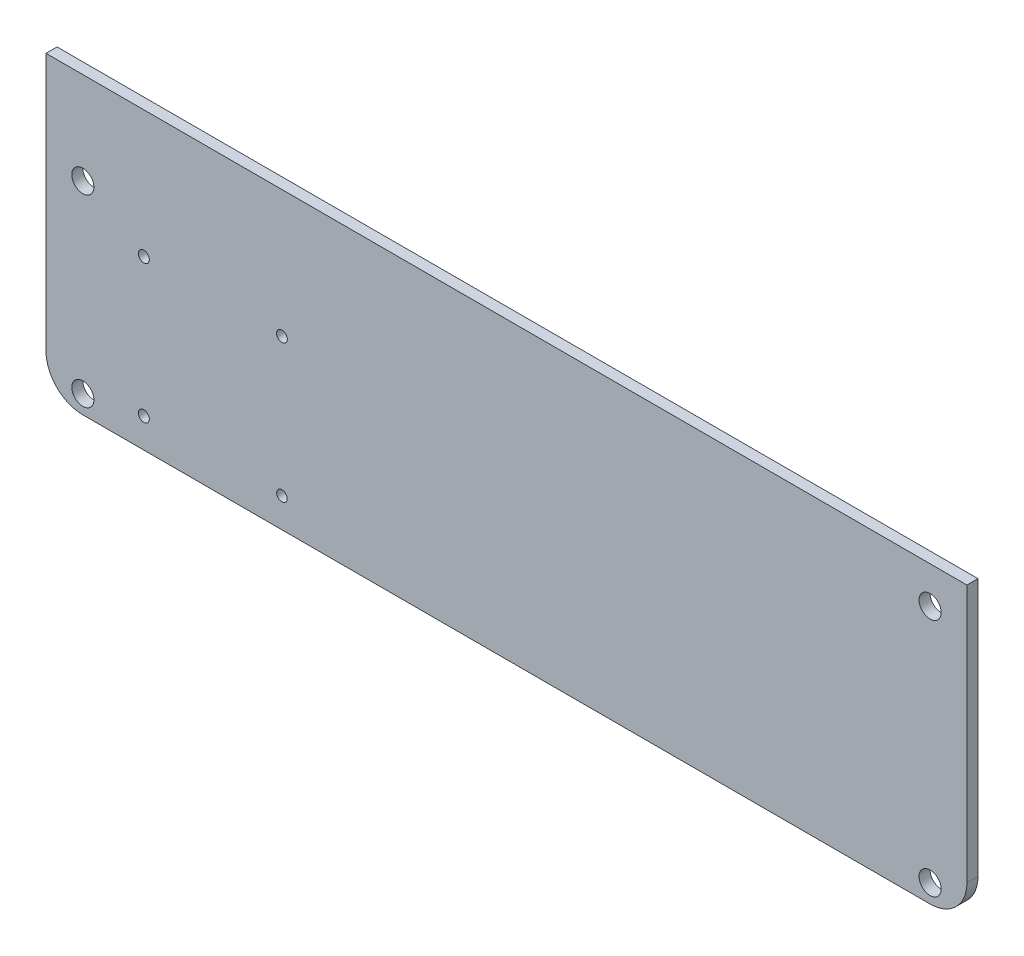
from build123d import *

# Parameters (mm, degrees)
BOSS_EXTRU_1_DEPTH      = 3
ESQUISSE2_R             = 3
ENL_V_MAT_EXTRU_1_DEPTH = 3
ESQUISSE3_R             = 1.5
ESQUISSE3_R_2           = 1.456745064
ESQUISSE3_R_3           = 1.425181728
ENL_V_MAT_EXTRU_2_DEPTH = 10


with BuildPart() as part:
    # Esquisse1 → Boss.-Extru.1 (new body)
    with BuildSketch(Plane.XY):
        with BuildLine():
            Line((0, 0), (250, 0))
            Line((250, 0), (250, -70))
            ThreePointArc((250, -70), (247.071067812, -77.071067812), (240, -80))
            Line((240, -80), (10, -80))
            ThreePointArc((10, -80), (2.928932188, -77.071067812), (0, -70))
            Line((0, -70), (0, 0))
        make_face()
    extrude(amount=BOSS_EXTRU_1_DEPTH)

    # Esquisse2 → Enlèv. mat.-Extru.1 (cut)
    with BuildSketch(Plane.XY.offset(3)):
        with Locations((10, -75)):
            Circle(ESQUISSE2_R)
        with Locations((240, -75)):
            Circle(ESQUISSE2_R)
        with Locations((240, -10)):
            Circle(ESQUISSE2_R)
        with Locations((10, -25)):
            Circle(ESQUISSE2_R)
    extrude(amount=-ENL_V_MAT_EXTRU_1_DEPTH, mode=Mode.SUBTRACT)

    # Esquisse3 → Enlèv. mat.-Extru.2 (cut)
    with BuildSketch(Plane.XY.offset(3)):
        with Locations((26.549426967, -34.5)):
            Circle(ESQUISSE3_R)
        with Locations((64.049426967, -34.5)):
            Circle(ESQUISSE3_R_2)
        with Locations((64.049426967, -72)):
            Circle(ESQUISSE3_R_3)
        with Locations((26.549426967, -72)):
            Circle(ESQUISSE3_R)
    extrude(amount=-ENL_V_MAT_EXTRU_2_DEPTH, mode=Mode.SUBTRACT)


solid = part.part
